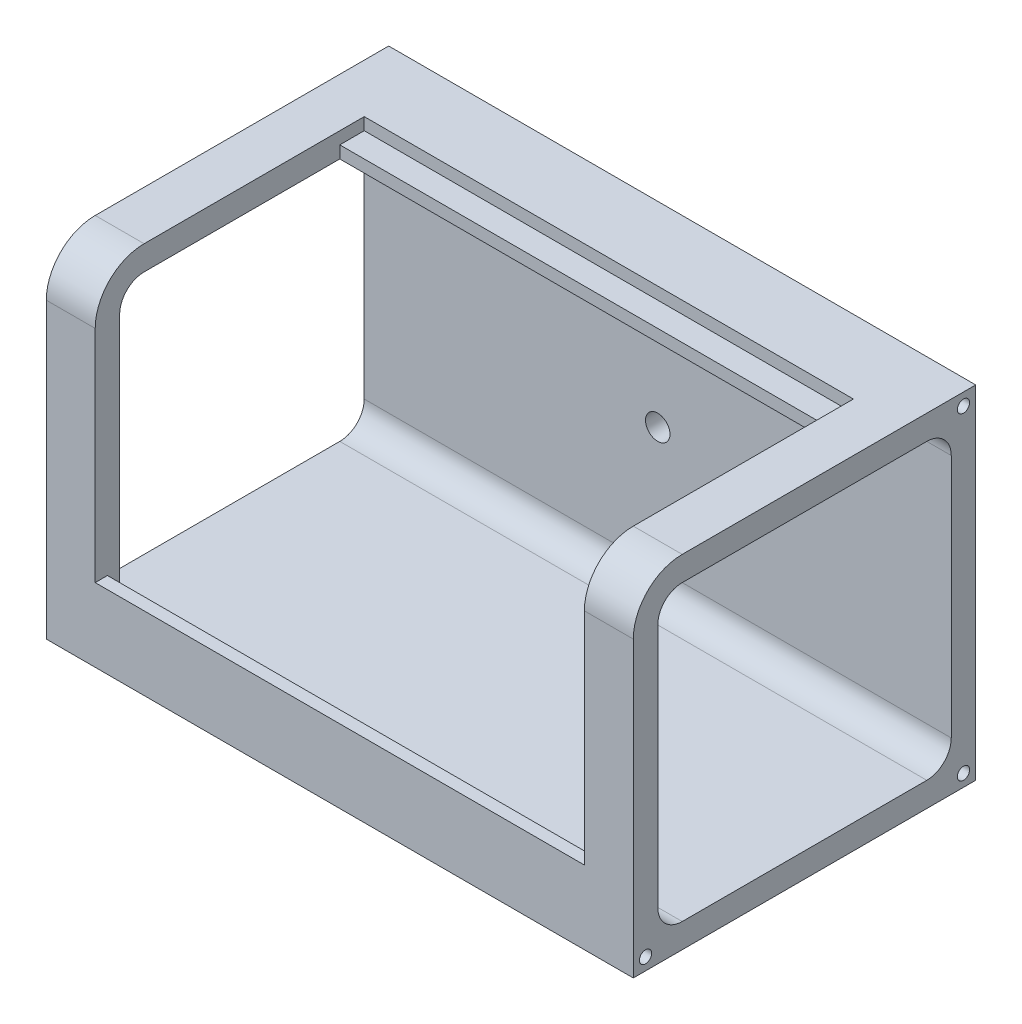
from build123d import *

# Parameters (mm, degrees)
EXTRUDE_1_DEPTH     = 20
EXTRUDE_2_DEPTH     = 200
EXTRUDE_3_DEPTH     = 20
SKETCH_5_R          = 2.5
CUT_EXTRUDE_1_DEPTH = 10
CUT_EXTRUDE_START   = -10
SKETCH_6_R          = 2.5
CUT_EXTRUDE_2_DEPTH = 10
CUT_EXTRUDE_3_REACH = 304.324
SKETCH_7_R          = 5


with BuildPart() as part:
    # 草图1 → 凸台-拉伸1 (new body)
    with BuildSketch(Plane(origin=(0, 0, 0), x_dir=(0, 0, -1), z_dir=(1, 0, 0))):
        with BuildLine():
            Line((10, 130), (130, 130))
            Line((130, 130), (130, -10))
            Line((130, -10), (-10, -10))
            Line((-10, -10), (-10, 110))
            ThreePointArc((-10, 110), (-4.142135624, 124.142135624), (10, 130))
        make_face()
        with BuildLine():
            Line((10, 0), (110, 0))
            ThreePointArc((110, 0), (117.071067812, 2.928932188), (120, 10))
            Line((120, 10), (120, 110))
            ThreePointArc((120, 110), (117.071067812, 117.071067812), (110, 120))
            Line((110, 120), (10, 120))
            ThreePointArc((10, 120), (2.928932188, 117.071067812), (0, 110))
            Line((0, 110), (0, 10))
            ThreePointArc((0, 10), (2.928932188, 2.928932188), (10, 0))
        make_face(mode=Mode.SUBTRACT)
    extrude(amount=EXTRUDE_1_DEPTH)

    # 草图2 → 凸台-拉伸2 (add)
    with BuildSketch(Plane(origin=(20, 0, 0), x_dir=(0, 0, -1), z_dir=(1, 0, 0))):
        with BuildLine():
            Line((130, 130), (100, 130))
            Line((100, 130), (100, 125))
            Line((100, 125), (90, 125))
            Line((90, 125), (90, 120))
            Line((90, 120), (107.421459813, 120))
            Line((107.421459813, 120), (110, 120))
            ThreePointArc((110, 120), (117.071067812, 117.071067812), (120, 110))
            Line((120, 110), (120, 10))
            ThreePointArc((120, 10), (117.071067812, 2.928932188), (110, 0))
            Line((110, 0), (10, 0))
            ThreePointArc((10, 0), (2.928932188, 2.928932188), (0, 10))
            Line((0, 10), (-5, 10))
            Line((-5, 10), (-5, 20))
            Line((-5, 20), (-10, 20))
            Line((-10, 20), (-10, 10))
            Line((-10, 10), (-10, -10))
            Line((-10, -10), (130, -10))
            Line((130, -10), (130, 130))
        make_face()
    extrude(amount=EXTRUDE_2_DEPTH)

    # 草图3 → 凸台-拉伸3 (add)
    with BuildSketch(Plane(origin=(220, 0, 0), x_dir=(0, 0, -1), z_dir=(1, 0, 0))):
        with BuildLine():
            Line((130, 130), (10, 130))
            ThreePointArc((10, 130), (-4.142135624, 124.142135624), (-10, 110))
            Line((-10, 110), (-10, -10))
            Line((-10, -10), (130, -10))
            Line((130, -10), (130, 130))
        make_face()
        with BuildLine():
            Line((0, 110), (0, 10))
            ThreePointArc((0, 10), (2.928932188, 2.928932188), (10, 0))
            Line((10, 0), (110, 0))
            ThreePointArc((110, 0), (117.071067812, 2.928932188), (120, 10))
            Line((120, 10), (120, 110))
            ThreePointArc((120, 110), (117.071067812, 117.071067812), (110, 120))
            Line((110, 120), (10, 120))
            ThreePointArc((10, 120), (2.928932188, 117.071067812), (0, 110))
        make_face(mode=Mode.SUBTRACT)
    extrude(amount=EXTRUDE_3_DEPTH)

    # 草图5 → 切除-拉伸1 (cut)
    with BuildSketch(Plane(origin=(240, 0, 0), x_dir=(0, 0, -1), z_dir=(1, 0, 0))):
        with Locations((-5, -5)):
            Circle(SKETCH_5_R)
        with Locations((125, -5)):
            Circle(SKETCH_5_R)
        with Locations((125, 125)):
            Circle(SKETCH_5_R)
    extrude(amount=-CUT_EXTRUDE_1_DEPTH, mode=Mode.SUBTRACT)

    # 草图6 → 切除-拉伸2 (cut)
    with BuildSketch(Plane.ZY.offset(CUT_EXTRUDE_START)):
        with Locations(Location((-125, 125, 0), (0, 0, 180))):
            Circle(SKETCH_6_R)
        with Locations(Location((-125, -5, 0), (0, 0, 180))):
            Circle(SKETCH_6_R)
        with Locations(Location((5, -5, 0), (0, 0, 180))):
            Circle(SKETCH_6_R)
    extrude(amount=CUT_EXTRUDE_2_DEPTH, mode=Mode.SUBTRACT)

    # 草图7 → 切除-拉伸3 (cut, up to next)
    with BuildSketch(Plane.XY.offset(-120), mode=Mode.PRIVATE) as cut_extrude_3_sk1:
        with Locations((120, 60)):
            Circle(SKETCH_7_R)
    cut_extrude_3_tool1 = extrude(cut_extrude_3_sk1.sketch, amount=-CUT_EXTRUDE_3_REACH, mode=Mode.PRIVATE) & part.part
    add(cut_extrude_3_tool1.solids().sort_by_distance((120, 60, -120))[0], mode=Mode.SUBTRACT)


solid = part.part
